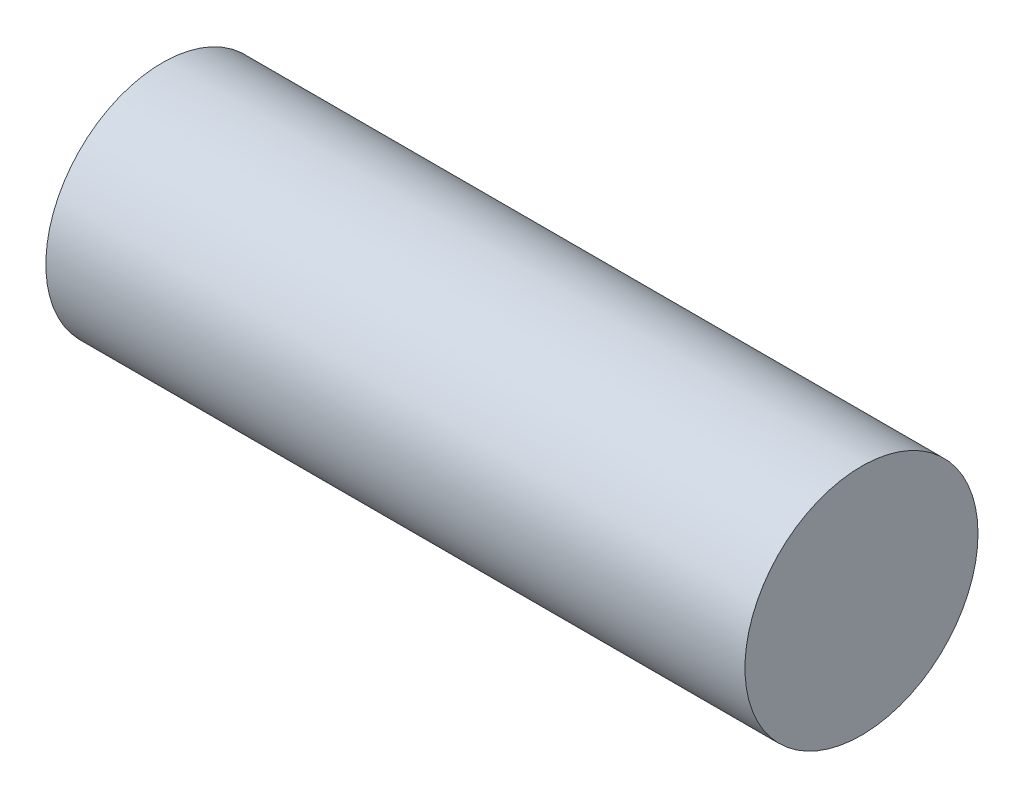
from build123d import *

# Parameters (mm, degrees)
SKETCH1_R           = 76.2
BOSS_EXTRUDE1_DEPTH = 457.2


with BuildPart() as part:
    # Sketch1 → Boss-Extrude1 (new body)
    with BuildSketch(Plane(origin=(0, 0, 0), x_dir=(0, 0, -1), z_dir=(1, 0, 0))):
        Circle(SKETCH1_R)
    extrude(amount=BOSS_EXTRUDE1_DEPTH)


solid = part.part
